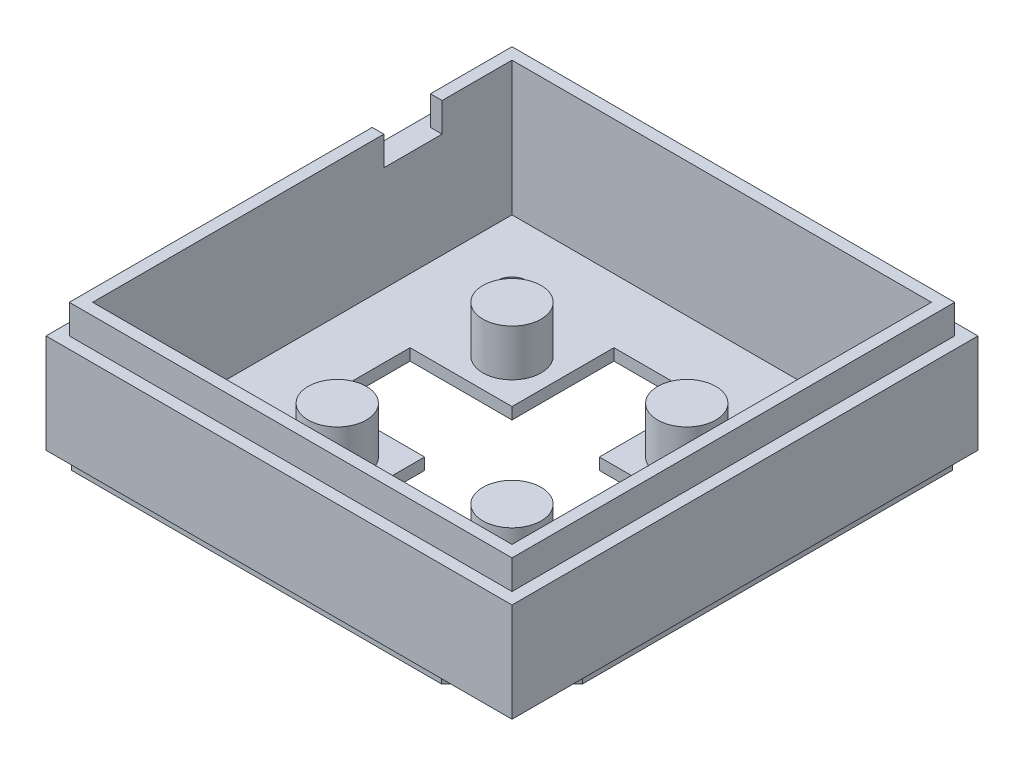
from build123d import *

# Parameters (mm, degrees)
ESQUISSE1_W              = 80
ESQUISSE1_H              = 80
BOSS_EXTRU_1_DEPTH       = 20
ESQUISSE2_W              = 76
ESQUISSE2_H              = 76
BOSS_EXTRU_2_DEPTH       = 5
ESQUISSE3_W              = 72
ESQUISSE3_H              = 72
ENL_V_MAT_EXTRU_2_DEPTH  = 23
ESQUISSE4_W              = 15
ESQUISSE4_H              = 17.5
ESQUISSE4_W_2            = 17.5
ESQUISSE4_H_2            = 15
ENL_V_MAT_EXTRU_9_DEPTH  = 10
ESQUISSE7_R              = 2.5
ENL_V_MAT_EXTRU_4_DEPTH  = 10
ESQUISSE5_R              = 5
BOSS_EXTRU_6_DEPTH       = 10
ESQUISSE9_R              = 2
ENL_V_MAT_EXTRU_6_DEPTH  = 8
ESQUISSE10_W             = 2
ESQUISSE10_H             = 10
ENL_V_MAT_EXTRU_7_DEPTH  = 5
ESQUISSE11_OUTSIDE_W     = 105.174
ESQUISSE11_OUTSIDE_H     = 105.174
ESQUISSE11_OUTSIDE_W_2   = 75.6
ESQUISSE11_OUTSIDE_H_2   = 75.6
ENL_V_MAT_EXTRU_10_DEPTH = 3
BOSS_EXTRU_7_REACH       = 131.891
BOSS_EXTRU_7_START       = -15
ENL_V_MAT_EXTRU_11_DEPTH = 3


with BuildPart() as part:
    # Esquisse1 → Boss.-Extru.1 (new body)
    with BuildSketch(Plane(origin=(0, 0, 0), x_dir=(1, 0, 0), z_dir=(0, 1, 0))):
        with Locations((40, -40)):
            Rectangle(ESQUISSE1_W, ESQUISSE1_H)
    extrude(amount=BOSS_EXTRU_1_DEPTH)

    # Esquisse2 → Boss.-Extru.2 (add)
    with BuildSketch(Plane(origin=(0, 20, 0), x_dir=(1, 0, 0), z_dir=(0, 1, 0))):
        with Locations((40, -40)):
            Rectangle(ESQUISSE2_W, ESQUISSE2_H)
    extrude(amount=BOSS_EXTRU_2_DEPTH)

    # Esquisse3 → Enlèv. mat.-Extru.2 (cut)
    with BuildSketch(Plane(origin=(0, 25, 0), x_dir=(1, 0, 0), z_dir=(0, 1, 0))):
        with Locations((40, -40)):
            Rectangle(ESQUISSE3_W, ESQUISSE3_H)
    extrude(amount=-ENL_V_MAT_EXTRU_2_DEPTH, mode=Mode.SUBTRACT)

    # Esquisse4 → Enlèv. mat.-Extru.9 (cut)
    with BuildSketch(Plane.XZ):
        with Locations((40, 23.75)):
            Rectangle(ESQUISSE4_W, ESQUISSE4_H)
        with Locations((23.75, 40)):
            Rectangle(ESQUISSE4_W_2, ESQUISSE4_H_2)
        with Locations((40, 40)):
            Rectangle(ESQUISSE4_W, ESQUISSE4_H_2)
        with Locations((56.25, 40)):
            Rectangle(ESQUISSE4_W_2, ESQUISSE4_H_2)
        with Locations((40, 56.25)):
            Rectangle(ESQUISSE4_W, ESQUISSE4_H)
    extrude(amount=-ENL_V_MAT_EXTRU_9_DEPTH, mode=Mode.SUBTRACT)

    # Esquisse7 → Enlèv. mat.-Extru.4 (cut)
    with BuildSketch(Plane(origin=(0, 0, 0), x_dir=(-1, 0, 0), z_dir=(0, -1, 0))):
        with Locations(Location((-15, -15, 0), (0, 0, 90))):
            Circle(ESQUISSE7_R)
        with Locations(Location((-15, -65, 0), (0, 0, 90))):
            Circle(ESQUISSE7_R)
        with Locations(Location((-65, -15, 0), (0, 0, 90))):
            Circle(ESQUISSE7_R)
        with Locations(Location((-65, -65, 0), (0, 0, 90))):
            Circle(ESQUISSE7_R)
    extrude(amount=-ENL_V_MAT_EXTRU_4_DEPTH, mode=Mode.SUBTRACT)

    # Esquisse5 → Boss.-Extru.6 (add)
    with BuildSketch(Plane(origin=(0, 0, 0), x_dir=(-1, 0, 0), z_dir=(0, -1, 0))):
        with Locations(Location((-55, -25, 0), (0, 0, 90))):
            Circle(ESQUISSE5_R)
        with Locations(Location((-55, -55, 0), (0, 0, 90))):
            Circle(ESQUISSE5_R)
        with Locations(Location((-25, -55, 0), (0, 0, 90))):
            Circle(ESQUISSE5_R)
        with Locations(Location((-25, -25, 0), (0, 0, 90))):
            Circle(ESQUISSE5_R)
    extrude(amount=-BOSS_EXTRU_6_DEPTH)

    # Esquisse9 → Enlèv. mat.-Extru.6 (cut)
    with BuildSketch(Plane(origin=(0, 0, 0), x_dir=(-1, 0, 0), z_dir=(0, -1, 0))):
        with Locations(Location((-55, -25, 0), (0, 0, 90))):
            Circle(ESQUISSE9_R)
        with Locations(Location((-55, -55, 0), (0, 0, 90))):
            Circle(ESQUISSE9_R)
        with Locations(Location((-25, -25, 0), (0, 0, 90))):
            Circle(ESQUISSE9_R)
        with Locations(Location((-25, -55, 0), (0, 0, 90))):
            Circle(ESQUISSE9_R)
    extrude(amount=-ENL_V_MAT_EXTRU_6_DEPTH, mode=Mode.SUBTRACT)

    # Esquisse10 → Enlèv. mat.-Extru.7 (cut)
    with BuildSketch(Plane(origin=(0, 25, 0), x_dir=(1, 0, 0), z_dir=(0, 1, 0))):
        with Locations((3, -21)):
            Rectangle(ESQUISSE10_W, ESQUISSE10_H)
    extrude(amount=-ENL_V_MAT_EXTRU_7_DEPTH, mode=Mode.SUBTRACT)

    # Esquisse11 outside → Enlèv. mat.-Extru.10 (cut)
    with BuildSketch(Plane(origin=(0, 0, 0), x_dir=(-1, 0, 0), z_dir=(0, -1, 0))):
        with Locations((-40, -40)):
            Rectangle(ESQUISSE11_OUTSIDE_W, ESQUISSE11_OUTSIDE_H)
        with Locations((-40, -40)):
            Rectangle(ESQUISSE11_OUTSIDE_W_2, ESQUISSE11_OUTSIDE_H_2, mode=Mode.SUBTRACT)
    extrude(amount=-ENL_V_MAT_EXTRU_10_DEPTH, mode=Mode.SUBTRACT)

    # Esquisse14 → Boss.-Extru.7 (add, up to next)
    with BuildSketch(Plane(origin=(0, 20, 0), x_dir=(1, 0, 0), z_dir=(0, 1, 0)).offset(BOSS_EXTRU_7_START), mode=Mode.PRIVATE) as boss_extru_7_sk1:
        Polygon((76, -76), (76, -65.703145172), (66.703318607, -76), align=None)
    boss_extru_7_tool1 = extrude(boss_extru_7_sk1.sketch, amount=-BOSS_EXTRU_7_REACH, mode=Mode.PRIVATE) - part.part
    add(boss_extru_7_tool1.solids().sort_by_distance((72.901106, 5, 72.567715))[0])

    # Esquisse13 → Enlèv. mat.-Extru.11 (cut)
    with BuildSketch(Plane(origin=(0, 0, 0), x_dir=(-1, 0, 0), z_dir=(0, -1, 0))):
        Polygon((-63.5, -80), (-80, -63.5), (-80, -80), align=None)
    extrude(amount=-ENL_V_MAT_EXTRU_11_DEPTH, mode=Mode.SUBTRACT)


solid = part.part
